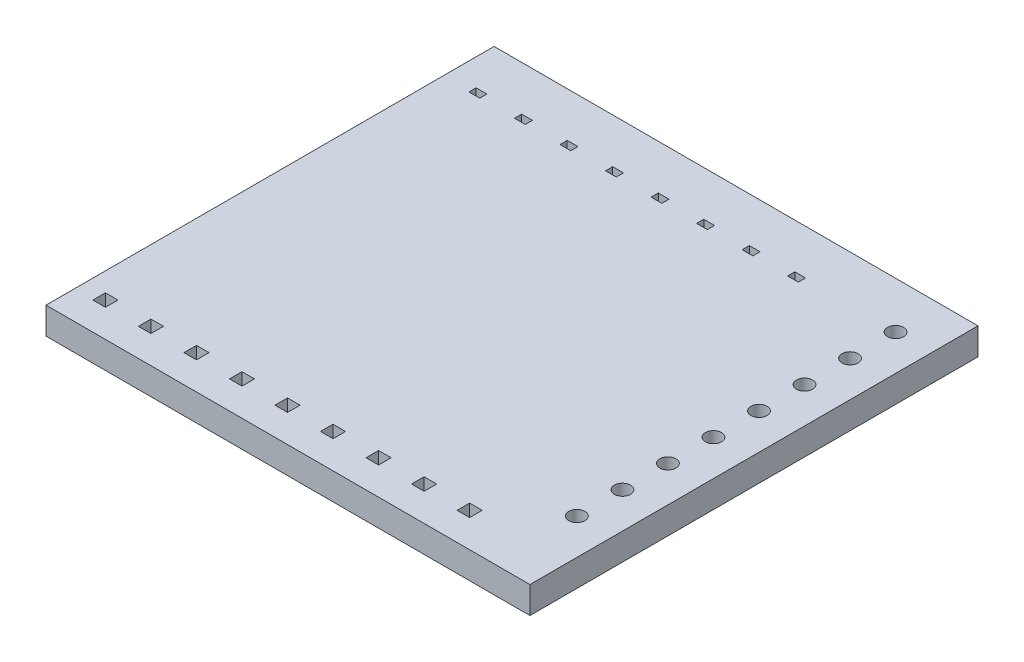
from build123d import *

# Parameters (mm, degrees)
SKETCH_1_W          = 27
SKETCH_1_H          = 25
EXTRUDE_1_DEPTH     = 1.5
SKETCH_2_R          = 0.45
SKETCH_2_W          = 0.6
SKETCH_2_H          = 0.4
SKETCH_2_W_2        = 0.7
SKETCH_2_H_2        = 0.7
CUT_EXTRUDE_1_DEPTH = 19.459414942


with BuildPart() as part:
    # Эскиз1 → Бобышка-Вытянуть1 (new body)
    with BuildSketch(Plane(origin=(0, 0, 0), x_dir=(1, 0, 0), z_dir=(0, 1, 0))):
        Rectangle(SKETCH_1_W, SKETCH_1_H)
    extrude(amount=EXTRUDE_1_DEPTH)

    # Эскиз2 → Вырез-Вытянуть1 (cut, through all)
    with BuildSketch(Plane(origin=(0, 1.5, 0), x_dir=(1, 0, 0), z_dir=(0, 1, 0))):
        with Locations(Location((11.5, 9.9, 0), (0, 0, 270))):
            Circle(SKETCH_2_R)
        with Locations(Location((11.5, 7.36, 0), (0, 0, 270))):
            Circle(SKETCH_2_R)
        with Locations(Location((11.5, 4.82, 0), (0, 0, 270))):
            Circle(SKETCH_2_R)
        with Locations(Location((11.5, 2.28, 0), (0, 0, 270))):
            Circle(SKETCH_2_R)
        with Locations(Location((11.5, -0.26, 0), (0, 0, 270))):
            Circle(SKETCH_2_R)
        with Locations(Location((11.5, -2.8, 0), (0, 0, 270))):
            Circle(SKETCH_2_R)
        with Locations(Location((11.5, -5.34, 0), (0, 0, 270))):
            Circle(SKETCH_2_R)
        with Locations(Location((11.5, -7.88, 0), (0, 0, 270))):
            Circle(SKETCH_2_R)
        with Locations((-9.16, 9.8)):
            Rectangle(SKETCH_2_W, SKETCH_2_H)
        with Locations((-11.7, 9.8)):
            Rectangle(SKETCH_2_W, SKETCH_2_H)
        with Locations((-6.62, 9.8)):
            Rectangle(SKETCH_2_W, SKETCH_2_H)
        with Locations((-4.08, 9.8)):
            Rectangle(SKETCH_2_W, SKETCH_2_H)
        with Locations((-1.54, 9.8)):
            Rectangle(SKETCH_2_W, SKETCH_2_H)
        with Locations((1, 9.8)):
            Rectangle(SKETCH_2_W, SKETCH_2_H)
        with Locations((3.54, 9.8)):
            Rectangle(SKETCH_2_W, SKETCH_2_H)
        with Locations((6.08, 9.8)):
            Rectangle(SKETCH_2_W, SKETCH_2_H)
        with Locations((-9.547856055, -10.59636646)):
            Rectangle(SKETCH_2_W_2, SKETCH_2_H_2)
        with Locations((-7.007856055, -10.59636646)):
            Rectangle(SKETCH_2_W_2, SKETCH_2_H_2)
        with Locations((-4.467856055, -10.59636646)):
            Rectangle(SKETCH_2_W_2, SKETCH_2_H_2)
        with Locations((-1.927856055, -10.59636646)):
            Rectangle(SKETCH_2_W_2, SKETCH_2_H_2)
        with Locations((0.612143945, -10.59636646)):
            Rectangle(SKETCH_2_W_2, SKETCH_2_H_2)
        with Locations((3.152143945, -10.59636646)):
            Rectangle(SKETCH_2_W_2, SKETCH_2_H_2)
        with Locations((5.692143945, -10.59636646)):
            Rectangle(SKETCH_2_W_2, SKETCH_2_H_2)
        with Locations((8.232143945, -10.59636646)):
            Rectangle(SKETCH_2_W_2, SKETCH_2_H_2)
        with Locations((-12.087856055, -10.59636646)):
            Rectangle(SKETCH_2_W_2, SKETCH_2_H_2)
    extrude(amount=-CUT_EXTRUDE_1_DEPTH, mode=Mode.SUBTRACT)


solid = part.part
